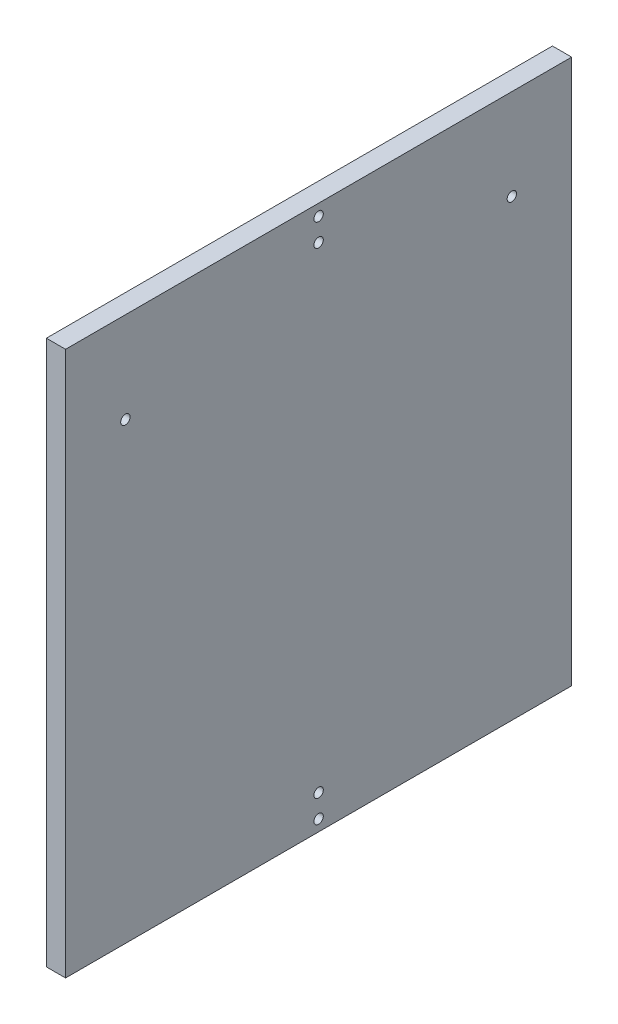
from build123d import *

# Parameters (mm, degrees)
SKETCH1_W                       = 167.3
SKETCH1_H                       = 180
BOSS_EXTRUDE1_DEPTH             = 6.35
SKETCH2_R                       = 1.55
CUT_EXTRUDE1_DEPTH              = 124.035137258
F_3_0MM_CLEARANCE_DOWEL_HOLE1_D = 3.108


with BuildPart() as part:
    # Sketch1 → Boss-Extrude1 (new body)
    with BuildSketch(Plane(origin=(0, 0, 0), x_dir=(0, 0, -1), z_dir=(1, 0, 0))):
        Rectangle(SKETCH1_W, SKETCH1_H)
    extrude(amount=BOSS_EXTRUDE1_DEPTH)

    # Sketch2 → Cut-Extrude1 (cut, through all)
    with BuildSketch(Plane.ZY):
        with Locations((-63.88304723, 60)):
            Circle(SKETCH2_R)
        with Locations((63.88304723, 60)):
            Circle(SKETCH2_R)
    extrude(amount=-CUT_EXTRUDE1_DEPTH, mode=Mode.SUBTRACT)

    # Ø3.0mm Clearance Dowel Hole1 (through all)
    with Locations(Plane.ZY):
        with Locations((0, 86.25), (0, 78.75), (0, -78.75), (0, -86.25)):
            Hole(F_3_0MM_CLEARANCE_DOWEL_HOLE1_D / 2)


solid = part.part
